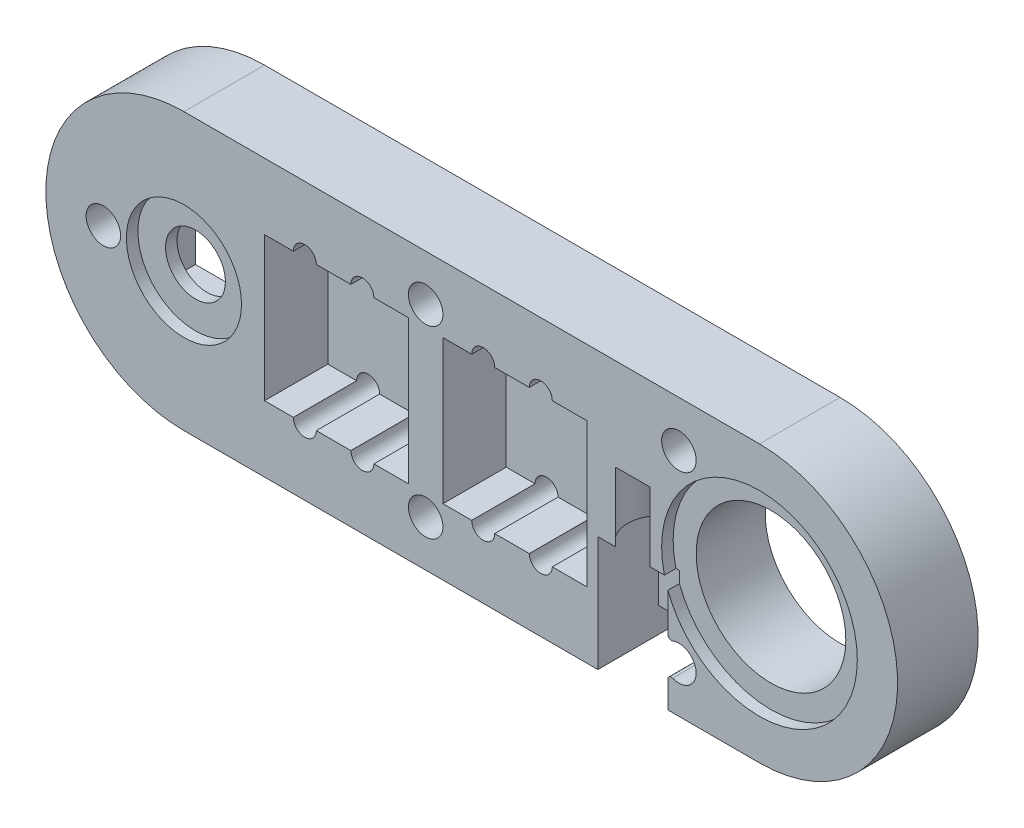
from build123d import *

# Parameters (mm, degrees)
EXTRUDE_1_DEPTH      = 7
SKETCH_4_W           = 12.5
SKETCH_4_H           = 12.5
CUT_EXTRUDE_1_DEPTH  = 5.5
SKETCH_5_R           = 2.6
SKETCH_5_R_2         = 6.5
CUT_EXTRUDE_2_DEPTH  = 64.474798149
SKETCH_6_R           = 1
CUT_EXTRUDE_3_DEPTH  = 64.474798149
EXTRUDE_2_DEPTH      = 7
SKETCH_9_W           = 12
SKETCH_9_H           = 12
CUT_EXTRUDE_5_DEPTH  = 5
SKETCH_10_R          = 2.75
CUT_EXTRUDE_6_DEPTH  = 16
SKETCH_11_W          = 6.086395164
SKETCH_11_H          = 5.94224859
CUT_EXTRUDE_7_DEPTH  = 10
SKETCH_13_W          = 6.086395164
SKETCH_13_H          = 2.190675797
CUT_EXTRUDE_8_DEPTH  = 10
SKETCH_14_R          = 1.5
CUT_EXTRUDE_9_DEPTH  = 10
FILLET_1_R           = 0.3
FILLET_2_R           = 0.3
SKETCH_15_R          = 5
SKETCH_15_R_2        = 8.5
CUT_EXTRUDE_10_DEPTH = 1


with BuildPart() as part:
    # Эскиз1 → Бобышка-Вытянуть1 (new body)
    with BuildSketch(Plane.XY):
        with BuildLine():
            Line((0, 0), (50, 0))
            ThreePointArc((50, 0), (59.9, -9.9), (50, -19.8))
            Line((50, -19.8), (0, -19.8))
            ThreePointArc((0, -19.8), (-9.9, -9.9), (0, 0))
        make_face()
    extrude(amount=EXTRUDE_1_DEPTH)

    # Эскиз4 → Вырез-Вытянуть1 (cut)
    with BuildSketch(Plane.XY.offset(7)):
        with Locations((13.25, -9.9)):
            Rectangle(SKETCH_4_W, SKETCH_4_H)
        with Locations((28.75, -9.9)):
            Rectangle(SKETCH_4_W, SKETCH_4_H)
    extrude(amount=-CUT_EXTRUDE_1_DEPTH, mode=Mode.SUBTRACT)

    # Эскиз5 → Вырез-Вытянуть2 (cut, through all)
    with BuildSketch(Plane.XY.offset(7)):
        with Locations((0, -9.9)):
            Circle(SKETCH_5_R)
        with Locations((50, -9.9)):
            Circle(SKETCH_5_R_2)
    extrude(amount=-CUT_EXTRUDE_2_DEPTH, mode=Mode.SUBTRACT)

    # Эскиз6 → Вырез-Вытянуть3 (cut, through all)
    with BuildSketch(Plane.XY.offset(7)):
        with Locations((10.5, -3.65)):
            Circle(SKETCH_6_R)
        with Locations((15.5, -3.65)):
            Circle(SKETCH_6_R)
        with Locations((26, -3.65)):
            Circle(SKETCH_6_R)
        with Locations((31, -3.65)):
            Circle(SKETCH_6_R)
        with Locations((10.5, -16.15)):
            Circle(SKETCH_6_R)
        with Locations((15.5, -16.15)):
            Circle(SKETCH_6_R)
        with Locations((26, -16.15)):
            Circle(SKETCH_6_R)
        with Locations((31, -16.15)):
            Circle(SKETCH_6_R)
    extrude(amount=-CUT_EXTRUDE_3_DEPTH, mode=Mode.SUBTRACT)

    # Эскиз8 → Бобышка-Вытянуть2 (add)
    with BuildSketch(Plane.XY.offset(7)):
        with BuildLine():
            Line((0, 2.1), (50, 2.1))
            ThreePointArc((50, 2.1), (62, -9.9), (50, -21.9))
            Line((50, -21.9), (0, -21.9))
            ThreePointArc((0, -21.9), (-12, -9.9), (0, 2.1))
        make_face()
        with BuildLine():
            Line((0, -0.209438441), (50, -0.209438441))
            ThreePointArc((50, -0.209438441), (59.690561559, -9.9), (50, -19.590561559))
            Line((50, -19.590561559), (0, -19.590561559))
            ThreePointArc((0, -19.590561559), (-9.690561559, -9.9), (0, -0.209438441))
        make_face(mode=Mode.SUBTRACT)
    extrude(amount=-EXTRUDE_2_DEPTH)

    # Эскиз9 → Вырез-Вытянуть5 (cut)
    with BuildSketch(Plane(origin=(0, 0, 0), x_dir=(-1, 0, 0), z_dir=(0, 0, -1))):
        with Locations((0, -9.9)):
            Rectangle(SKETCH_9_W, SKETCH_9_H)
    extrude(amount=-CUT_EXTRUDE_5_DEPTH, mode=Mode.SUBTRACT)

    # Эскиз10 → Вырез-Вытянуть6 (cut)
    with BuildSketch(Plane.XZ.offset(21.9)):
        with Locations((39, 4.7)):
            Circle(SKETCH_10_R)
    extrude(amount=-CUT_EXTRUDE_6_DEPTH, mode=Mode.SUBTRACT)

    # Эскиз11 → Вырез-Вытянуть7 (cut)
    with BuildSketch(Plane.XZ.offset(21.9)):
        with Locations((39, 4.7)):
            Rectangle(SKETCH_11_W, SKETCH_11_H)
    extrude(amount=-CUT_EXTRUDE_7_DEPTH, mode=Mode.SUBTRACT)

    # Эскиз13 → Вырез-Вытянуть8 (cut)
    with BuildSketch(Plane.XY.offset(1.728875705)):
        with Locations((39, -20.804662101)):
            Rectangle(SKETCH_13_W, SKETCH_13_H)
    extrude(amount=-CUT_EXTRUDE_8_DEPTH, mode=Mode.SUBTRACT)

    # Эскиз14 → Вырез-Вытянуть9 (cut)
    with BuildSketch(Plane.XY.offset(7)):
        with Locations((21, -1.9)):
            Circle(SKETCH_14_R)
        with Locations((21, -17.9)):
            Circle(SKETCH_14_R)
        with Locations((43, -1.9)):
            Circle(SKETCH_14_R)
        with Locations((-7, -9.9857634)):
            Circle(SKETCH_14_R)
        with Locations((43, -17.9)):
            Circle(SKETCH_14_R)
    extrude(amount=-CUT_EXTRUDE_9_DEPTH, mode=Mode.SUBTRACT)

    # Скругление1
    fillet_1_edges = [part.edges().sort_by_distance(p)[0] for p in [
        (-6, -8.867729411, 2.5),
        (-6, -11.103797388, 2.5),
    ]]
    fillet(fillet_1_edges, radius=FILLET_1_R)

    # Скругление2
    fillet_2_edges = [part.edges().sort_by_distance(p)[0] for p in [
        (42.043197582, -16.744781781, 4.364437853),
        (42.043197582, -19.055218219, 4.364437853),
    ]]
    fillet(fillet_2_edges, radius=FILLET_2_R)

    # Эскиз15 → Вырез-Вытянуть10 (cut)
    with BuildSketch(Plane.XY.offset(7)):
        with Locations((0, -9.9)):
            Circle(SKETCH_15_R)
        with Locations((50, -9.9)):
            Circle(SKETCH_15_R_2)
    extrude(amount=-CUT_EXTRUDE_10_DEPTH, mode=Mode.SUBTRACT)


solid = part.part
